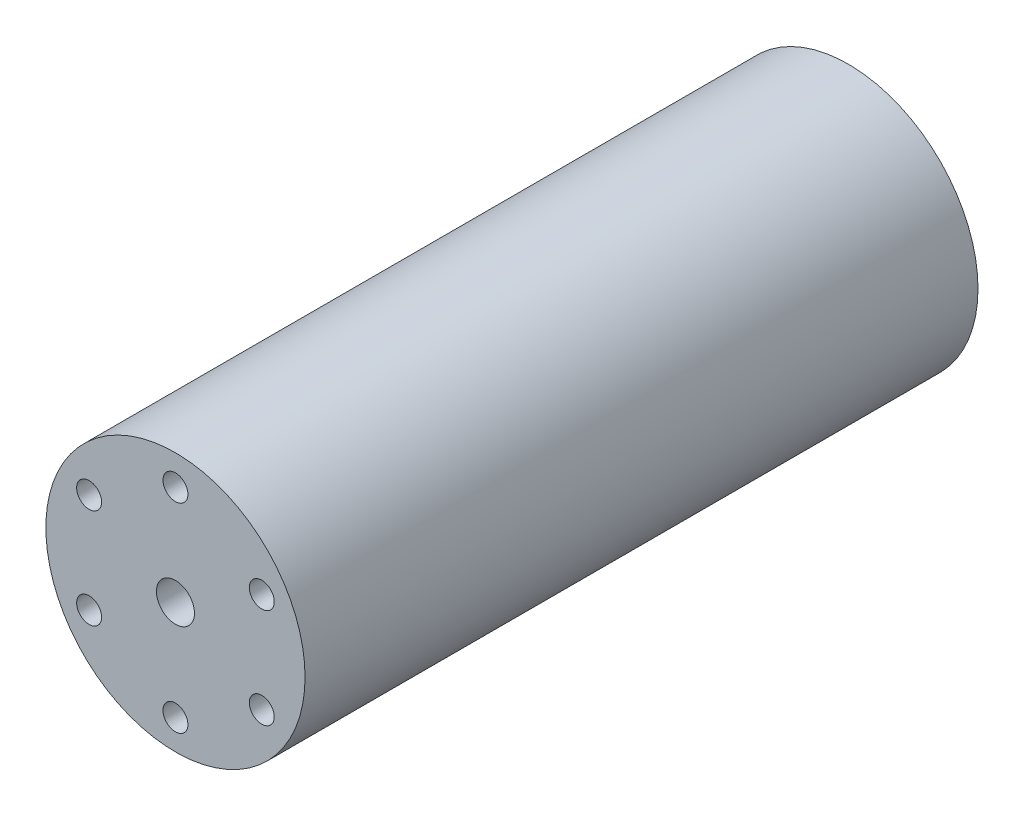
from build123d import *

# Parameters (mm, degrees)
SKETCH2_R           = 26
BOSS_EXTRUDE1_DEPTH = 135
SKETCH3_R           = 3.815
CUT_EXTRUDE1_DEPTH  = 135
SKETCH5_R           = 18.5
CUT_EXTRUDE2_DEPTH  = 30
SKETCH6_R           = 2.5
CUT_EXTRUDE3_DEPTH  = 5
SKETCH6_3_R         = 2.5
CUT_EXTRUDE4_DEPTH  = 5


with BuildPart() as part:
    # Sketch2 → Boss-Extrude1 (new body)
    with BuildSketch(Plane.XY):
        Circle(SKETCH2_R)
    extrude(amount=BOSS_EXTRUDE1_DEPTH)

    # Sketch3 → Cut-Extrude1 (cut)
    with BuildSketch(Plane(origin=(0, 0, 0), x_dir=(-1, 0, 0), z_dir=(0, 0, -1))):
        Circle(SKETCH3_R)
    extrude(amount=-CUT_EXTRUDE1_DEPTH, mode=Mode.SUBTRACT)

    # Sketch5 → Cut-Extrude2 (cut)
    with BuildSketch(Plane(origin=(0, 0, 0), x_dir=(-1, 0, 0), z_dir=(0, 0, -1))):
        Circle(SKETCH5_R)
    extrude(amount=-CUT_EXTRUDE2_DEPTH, mode=Mode.SUBTRACT)

    # Sketch6 → Cut-Extrude3 (cut)
    with BuildSketch(Plane.XY.offset(135)):
        with Locations((0, 20)):
            Circle(SKETCH6_R)
    extrude(amount=-CUT_EXTRUDE3_DEPTH, mode=Mode.SUBTRACT)

    # Sketch6<3> → Cut-Extrude4 (cut)
    with BuildSketch(Plane.XY.offset(135)):
        with Locations((0, 20)):
            Circle(SKETCH6_3_R)
        with Locations((17.320508076, 10)):
            Circle(SKETCH6_3_R)
        with Locations((17.320508076, -10)):
            Circle(SKETCH6_3_R)
        with Locations((0, -20)):
            Circle(SKETCH6_3_R)
        with Locations((-17.320508076, -10)):
            Circle(SKETCH6_3_R)
        with Locations((-17.320508076, 10)):
            Circle(SKETCH6_3_R)
    extrude(amount=-CUT_EXTRUDE4_DEPTH, mode=Mode.SUBTRACT)


solid = part.part
